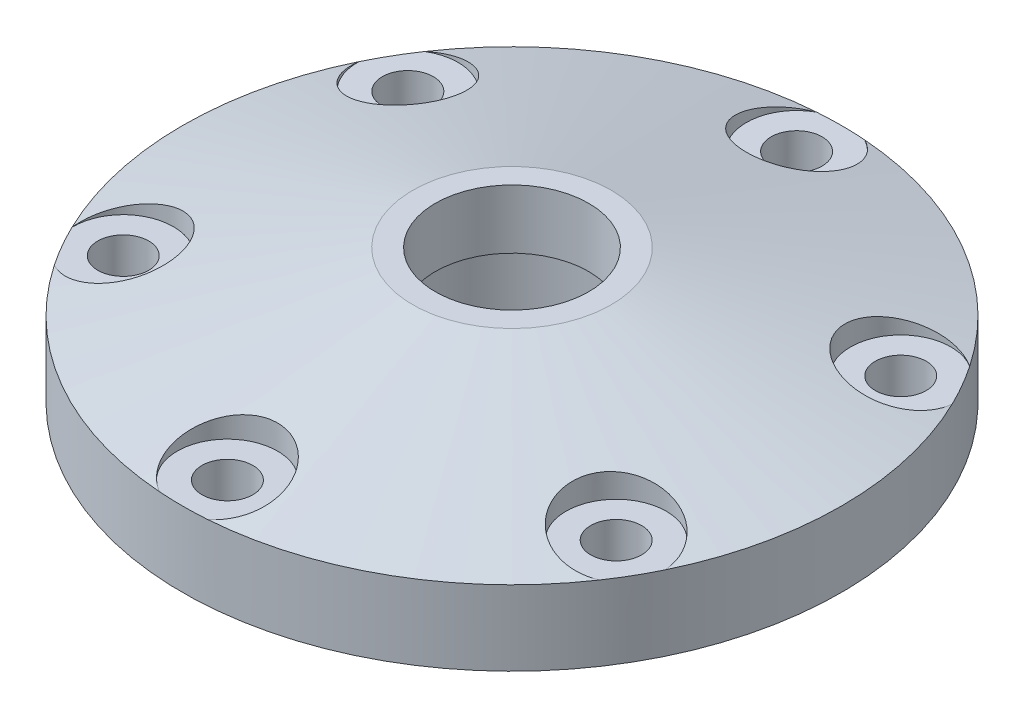
from build123d import *

# Parameters (mm, degrees)
M3_CLEARANCE_HOLE1_AT_2_COUNT  = 2
M3_CLEARANCE_HOLE1_AT_2_PITCH  = 19
M3_CLEARANCE_HOLE1_AT_3_COUNT  = 2
M3_CLEARANCE_HOLE1_AT_3_PITCH  = 32.908965344
M3_CLEARANCE_HOLE1_AT_4_COUNT  = 2
M3_CLEARANCE_HOLE1_AT_4_PITCH  = 38
M3_CLEARANCE_HOLE1_AT_5_COUNT  = 2
M3_CLEARANCE_HOLE1_AT_5_PITCH  = 32.908965344
M3_CLEARANCE_HOLE1_AT_6_COUNT  = 2
M3_CLEARANCE_HOLE1_AT_6_PITCH  = 19
M3_CLEARANCE_HOLE1_AT_7_COUNT  = 2
M3_CLEARANCE_HOLE1_AT_7_PITCH  = 19
CBORE_FOR_M3_SBHCS7_AT_2_COUNT = 2
CBORE_FOR_M3_SBHCS7_AT_2_PITCH = 19
CBORE_FOR_M3_SBHCS7_AT_3_COUNT = 2
CBORE_FOR_M3_SBHCS7_AT_3_PITCH = 32.908965344
CBORE_FOR_M3_SBHCS7_AT_4_COUNT = 2
CBORE_FOR_M3_SBHCS7_AT_4_PITCH = 38
CBORE_FOR_M3_SBHCS7_AT_5_COUNT = 2
CBORE_FOR_M3_SBHCS7_AT_5_PITCH = 32.908965344
CBORE_FOR_M3_SBHCS7_AT_6_COUNT = 2
CBORE_FOR_M3_SBHCS7_AT_6_PITCH = 19


with BuildPart() as part:
    # Sketch1 → Revolve1 (revolve)
    with BuildSketch(Plane.XY, mode=Mode.PRIVATE) as revolve1_sk:
        Polygon((5.12, 5), (5.12, 8.9453), (6.625, 8.9453), (22, 5), (22, 0), (6.75, 0), (6.75, 5), align=None)
    revolve(revolve1_sk.sketch.rotate(Axis((0, 0, 0), (0, 1, 0)), 90), axis=Axis((0, 0, 0), (0, 1, 0)))

    # Sketch3 → M3 Clearance Hole1 (revolve, cut)
    with BuildSketch(Plane(origin=(0, 5, -19), x_dir=(0, 0, 1), z_dir=(1, 0, 0))):
        Polygon((0, 0), (0, 6.021463052), (1.7, 5), (1.7, 0), align=None)
    m3_clearance_hole1 = revolve(axis=Axis((0, 11.35, -19), (0, -1, 0)), mode=Mode.SUBTRACT)

    # M3 Clearance Hole1 at 2: M3 Clearance Hole1 ×2
    with Locations(*[Vector(0.8660254037844387, 0, 0.49999999999999994) * (i * M3_CLEARANCE_HOLE1_AT_2_PITCH) for i in range(1, M3_CLEARANCE_HOLE1_AT_2_COUNT)]):
        add(m3_clearance_hole1, mode=Mode.SUBTRACT)

    # M3 Clearance Hole1 at 3: M3 Clearance Hole1 ×2
    with Locations(*[Vector(0.5000000000000001, 0, 0.8660254037844386) * (i * M3_CLEARANCE_HOLE1_AT_3_PITCH) for i in range(1, M3_CLEARANCE_HOLE1_AT_3_COUNT)]):
        add(m3_clearance_hole1, mode=Mode.SUBTRACT)

    # M3 Clearance Hole1 at 4: M3 Clearance Hole1 ×2
    with Locations(*[(0, 0, i * M3_CLEARANCE_HOLE1_AT_4_PITCH) for i in range(1, M3_CLEARANCE_HOLE1_AT_4_COUNT)]):
        add(m3_clearance_hole1, mode=Mode.SUBTRACT)

    # M3 Clearance Hole1 at 5: M3 Clearance Hole1 ×2
    with Locations(*[Vector(-0.49999999999999983, 0, 0.8660254037844388) * (i * M3_CLEARANCE_HOLE1_AT_5_PITCH) for i in range(1, M3_CLEARANCE_HOLE1_AT_5_COUNT)]):
        add(m3_clearance_hole1, mode=Mode.SUBTRACT)

    # M3 Clearance Hole1 at 6: M3 Clearance Hole1 ×2
    with Locations(*[Vector(-0.8660254037844387, 0, 0.4999999999999999) * (i * M3_CLEARANCE_HOLE1_AT_6_PITCH) for i in range(1, M3_CLEARANCE_HOLE1_AT_6_COUNT)]):
        add(m3_clearance_hole1, mode=Mode.SUBTRACT)

    # M3 Clearance Hole1 at 7: M3 Clearance Hole1 ×2
    with Locations(*[(0, 0, i * M3_CLEARANCE_HOLE1_AT_7_PITCH) for i in range(1, M3_CLEARANCE_HOLE1_AT_7_COUNT)]):
        add(m3_clearance_hole1, mode=Mode.SUBTRACT)

    # Sketch5 → CBORE for M3 SBHCS7 (revolve, cut)
    with BuildSketch(Plane(origin=(-16.454482672, 5, -9.5), x_dir=(0, 0, -1), z_dir=(1, 0, 0))):
        Polygon((0, 0), (0, 4.966763052), (1.7, 3.9453), (1.7, 1.65), (3.35, 1.65), (3.35, 0), align=None)
    cbore_for_m3_sbhcs7 = revolve(axis=Axis((-16.454482672, -1.35, -9.5), (0, 1, 0)), mode=Mode.SUBTRACT)

    # CBORE for M3 SBHCS7 at 2: CBORE for M3 SBHCS7 ×2
    with Locations(*[Vector(0.8660254037844387, 0, -0.4999999999999999) * (i * CBORE_FOR_M3_SBHCS7_AT_2_PITCH) for i in range(1, CBORE_FOR_M3_SBHCS7_AT_2_COUNT)]):
        add(cbore_for_m3_sbhcs7, mode=Mode.SUBTRACT)

    # CBORE for M3 SBHCS7 at 3: CBORE for M3 SBHCS7 ×2
    with Locations(*[(i * CBORE_FOR_M3_SBHCS7_AT_3_PITCH, 0, 0) for i in range(1, CBORE_FOR_M3_SBHCS7_AT_3_COUNT)]):
        add(cbore_for_m3_sbhcs7, mode=Mode.SUBTRACT)

    # CBORE for M3 SBHCS7 at 4: CBORE for M3 SBHCS7 ×2
    with Locations(*[Vector(0.8660254037844387, 0, 0.49999999999999994) * (i * CBORE_FOR_M3_SBHCS7_AT_4_PITCH) for i in range(1, CBORE_FOR_M3_SBHCS7_AT_4_COUNT)]):
        add(cbore_for_m3_sbhcs7, mode=Mode.SUBTRACT)

    # CBORE for M3 SBHCS7 at 5: CBORE for M3 SBHCS7 ×2
    with Locations(*[Vector(0.49999999999999994, 0, 0.8660254037844387) * (i * CBORE_FOR_M3_SBHCS7_AT_5_PITCH) for i in range(1, CBORE_FOR_M3_SBHCS7_AT_5_COUNT)]):
        add(cbore_for_m3_sbhcs7, mode=Mode.SUBTRACT)

    # CBORE for M3 SBHCS7 at 6: CBORE for M3 SBHCS7 ×2
    with Locations(*[(0, 0, i * CBORE_FOR_M3_SBHCS7_AT_6_PITCH) for i in range(1, CBORE_FOR_M3_SBHCS7_AT_6_COUNT)]):
        add(cbore_for_m3_sbhcs7, mode=Mode.SUBTRACT)


solid = part.part
